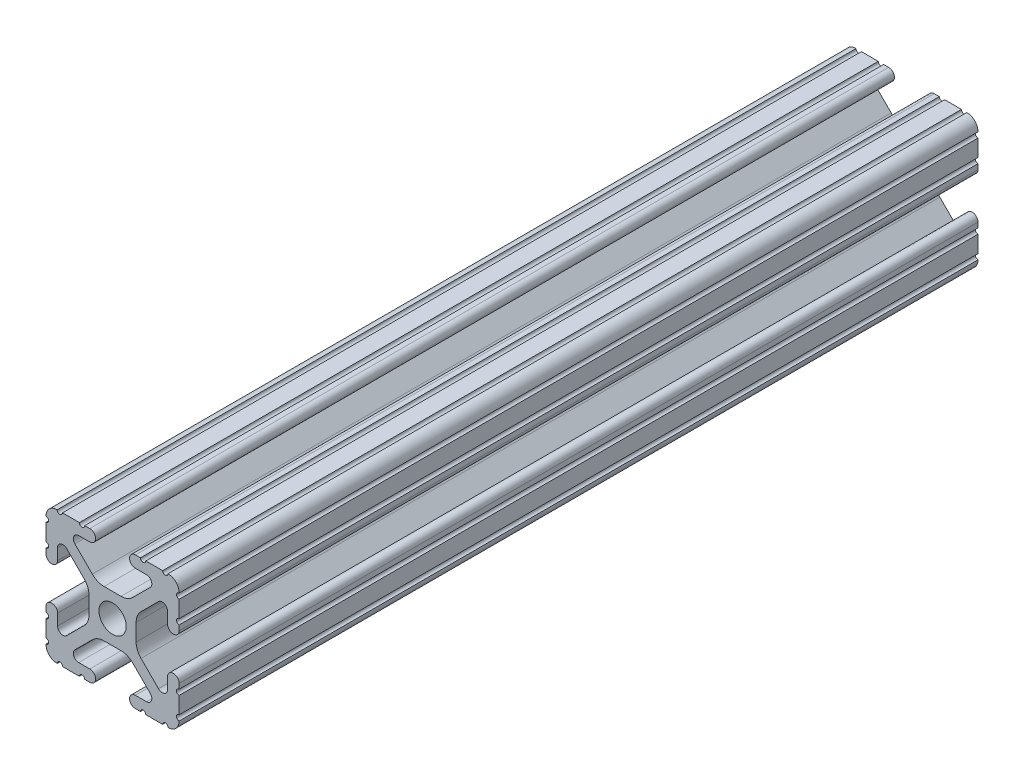
from build123d import *

# Parameters (mm, degrees)
SKETCH1_R           = 2.6035
BOSS_EXTRUDE1_DEPTH = 152.4


with BuildPart() as part:
    # Sketch1 → Boss-Extrude1 (new body)
    with BuildSketch(Plane(origin=(0, 0, -2463.8), x_dir=(-1, 0, 0), z_dir=(0, 0, -1))):
        with BuildLine():
            Line((12.7, -9.5504), (12.7, -6.3330836))
            ThreePointArc((12.7, -6.3330836), (12.192, -5.8250836), (12.7, -5.3170836))
            Line((12.7, -5.3170836), (12.7, -4.3434))
            ThreePointArc((12.7, -4.3434), (11.5951, -3.2385), (10.4902, -4.3434))
            Line((10.4902, -4.3434), (10.4902, -6.474794456))
            ThreePointArc((10.4902, -6.474794456), (9.863006367, -7.413456061), (8.75577951, -7.193214945))
            Line((8.75577951, -7.193214945), (5.42573597, -3.863171405))
            ThreePointArc((5.42573597, -3.863171405), (4.737482484, -2.833127272), (4.4958, -1.618107374))
            Line((4.4958, -1.618107374), (4.4958, 1.618107374))
            ThreePointArc((4.4958, 1.618107374), (4.737482484, 2.833127272), (5.42573597, 3.863171405))
            Line((5.42573597, 3.863171405), (8.75577951, 7.193214945))
            ThreePointArc((8.75577951, 7.193214945), (9.863006367, 7.413456061), (10.4902, 6.474794456))
            Line((10.4902, 6.474794456), (10.4902, 4.343399971))
            ThreePointArc((10.4902, 4.343399971), (11.5951, 3.238499971), (12.7, 4.343399971))
            Line((12.7, 4.343399971), (12.7, 5.3170836))
            ThreePointArc((12.7, 5.3170836), (12.192, 5.8250836), (12.7, 6.3330836))
            Line((12.7, 6.3330836), (12.7, 9.5504))
            ThreePointArc((12.7, 9.5504), (12.192000006, 10.058323491), (12.699846982, 10.566399977))
            ThreePointArc((12.699846982, 10.566399977), (12.082522516, 12.082522516), (10.566399977, 12.699846982))
            ThreePointArc((10.566399977, 12.699846982), (10.058323491, 12.192000006), (9.5504, 12.7))
            Line((9.5504, 12.7), (6.3330836, 12.7))
            ThreePointArc((6.3330836, 12.7), (5.8250836, 12.192), (5.3170836, 12.7))
            Line((5.3170836, 12.7), (4.3434, 12.7))
            ThreePointArc((4.3434, 12.7), (3.2385, 11.5951), (4.3434, 10.4902))
            Line((4.3434, 10.4902), (6.474794456, 10.4902))
            ThreePointArc((6.474794456, 10.4902), (7.413456061, 9.863006367), (7.193214945, 8.75577951))
            Line((7.193214945, 8.75577951), (3.863171405, 5.42573597))
            ThreePointArc((3.863171405, 5.42573597), (2.833127272, 4.737482484), (1.618107374, 4.4958))
            Line((1.618107374, 4.4958), (-1.618107374, 4.4958))
            ThreePointArc((-1.618107374, 4.4958), (-2.833127272, 4.737482484), (-3.863171405, 5.42573597))
            Line((-3.863171405, 5.42573597), (-7.193214945, 8.75577951))
            ThreePointArc((-7.193214945, 8.75577951), (-7.413456061, 9.863006367), (-6.474794456, 10.4902))
            Line((-6.474794456, 10.4902), (-4.343399971, 10.4902))
            ThreePointArc((-4.343399971, 10.4902), (-3.238499971, 11.5951), (-4.343399971, 12.7))
            Line((-4.343399971, 12.7), (-5.3170836, 12.7))
            ThreePointArc((-5.3170836, 12.7), (-5.8250836, 12.192), (-6.3330836, 12.7))
            Line((-6.3330836, 12.7), (-9.5504, 12.7))
            ThreePointArc((-9.5504, 12.7), (-10.058323491, 12.192000006), (-10.566399977, 12.699846982))
            ThreePointArc((-10.566399977, 12.699846982), (-12.082522516, 12.082522516), (-12.699846982, 10.566399977))
            ThreePointArc((-12.699846982, 10.566399977), (-12.192000006, 10.058323491), (-12.7, 9.5504))
            Line((-12.7, 9.5504), (-12.7, 6.3330836))
            ThreePointArc((-12.7, 6.3330836), (-12.192, 5.8250836), (-12.7, 5.3170836))
            Line((-12.7, 5.3170836), (-12.7, 4.3434))
            ThreePointArc((-12.7, 4.3434), (-11.5951, 3.2385), (-10.4902, 4.3434))
            Line((-10.4902, 4.3434), (-10.4902, 6.474794456))
            ThreePointArc((-10.4902, 6.474794456), (-9.863006367, 7.413456061), (-8.75577951, 7.193214945))
            Line((-8.75577951, 7.193214945), (-5.42573597, 3.863171405))
            ThreePointArc((-5.42573597, 3.863171405), (-4.737482484, 2.833127272), (-4.4958, 1.618107374))
            Line((-4.4958, 1.618107374), (-4.4958, -1.618107374))
            ThreePointArc((-4.4958, -1.618107374), (-4.737482484, -2.833127272), (-5.42573597, -3.863171405))
            Line((-5.42573597, -3.863171405), (-8.75577951, -7.193214945))
            ThreePointArc((-8.75577951, -7.193214945), (-9.863006367, -7.413456061), (-10.4902, -6.474794456))
            Line((-10.4902, -6.474794456), (-10.4902, -4.343399971))
            ThreePointArc((-10.4902, -4.343399971), (-11.5951, -3.238499971), (-12.7, -4.343399971))
            Line((-12.7, -4.343399971), (-12.7, -5.3170836))
            ThreePointArc((-12.7, -5.3170836), (-12.192, -5.8250836), (-12.7, -6.3330836))
            Line((-12.7, -6.3330836), (-12.7, -9.5504))
            ThreePointArc((-12.7, -9.5504), (-12.192000006, -10.058323491), (-12.699846982, -10.566399977))
            ThreePointArc((-12.699846982, -10.566399977), (-12.082522516, -12.082522516), (-10.566399977, -12.699846982))
            ThreePointArc((-10.566399977, -12.699846982), (-10.058323491, -12.192000006), (-9.5504, -12.7))
            Line((-9.5504, -12.7), (-6.3330836, -12.7))
            ThreePointArc((-6.3330836, -12.7), (-5.8250836, -12.192), (-5.3170836, -12.7))
            Line((-5.3170836, -12.7), (-4.3434, -12.7))
            ThreePointArc((-4.3434, -12.7), (-3.2385, -11.5951), (-4.3434, -10.4902))
            Line((-4.3434, -10.4902), (-6.474794456, -10.4902))
            ThreePointArc((-6.474794456, -10.4902), (-7.413456061, -9.863006367), (-7.193214945, -8.75577951))
            Line((-7.193214945, -8.75577951), (-3.863171405, -5.42573597))
            ThreePointArc((-3.863171405, -5.42573597), (-2.833127272, -4.737482484), (-1.618107374, -4.4958))
            Line((-1.618107374, -4.4958), (1.618107374, -4.4958))
            ThreePointArc((1.618107374, -4.4958), (2.833127272, -4.737482484), (3.863171405, -5.42573597))
            Line((3.863171405, -5.42573597), (7.193214945, -8.75577951))
            ThreePointArc((7.193214945, -8.75577951), (7.413456061, -9.863006367), (6.474794456, -10.4902))
            Line((6.474794456, -10.4902), (4.343399971, -10.4902))
            ThreePointArc((4.343399971, -10.4902), (3.238499971, -11.5951), (4.343399971, -12.7))
            Line((4.343399971, -12.7), (5.3170836, -12.7))
            ThreePointArc((5.3170836, -12.7), (5.8250836, -12.192), (6.3330836, -12.7))
            Line((6.3330836, -12.7), (9.5504, -12.7))
            ThreePointArc((9.5504, -12.7), (10.058323491, -12.192000006), (10.566399977, -12.699846982))
            ThreePointArc((10.566399977, -12.699846982), (12.082522516, -12.082522516), (12.699846982, -10.566399977))
            ThreePointArc((12.699846982, -10.566399977), (12.192000006, -10.058323491), (12.7, -9.5504))
        make_face()
        with Locations(Location((0, 0, 0), (0, 0, 180))):
            Circle(SKETCH1_R, mode=Mode.SUBTRACT)
    extrude(amount=BOSS_EXTRUDE1_DEPTH)


solid = part.part
